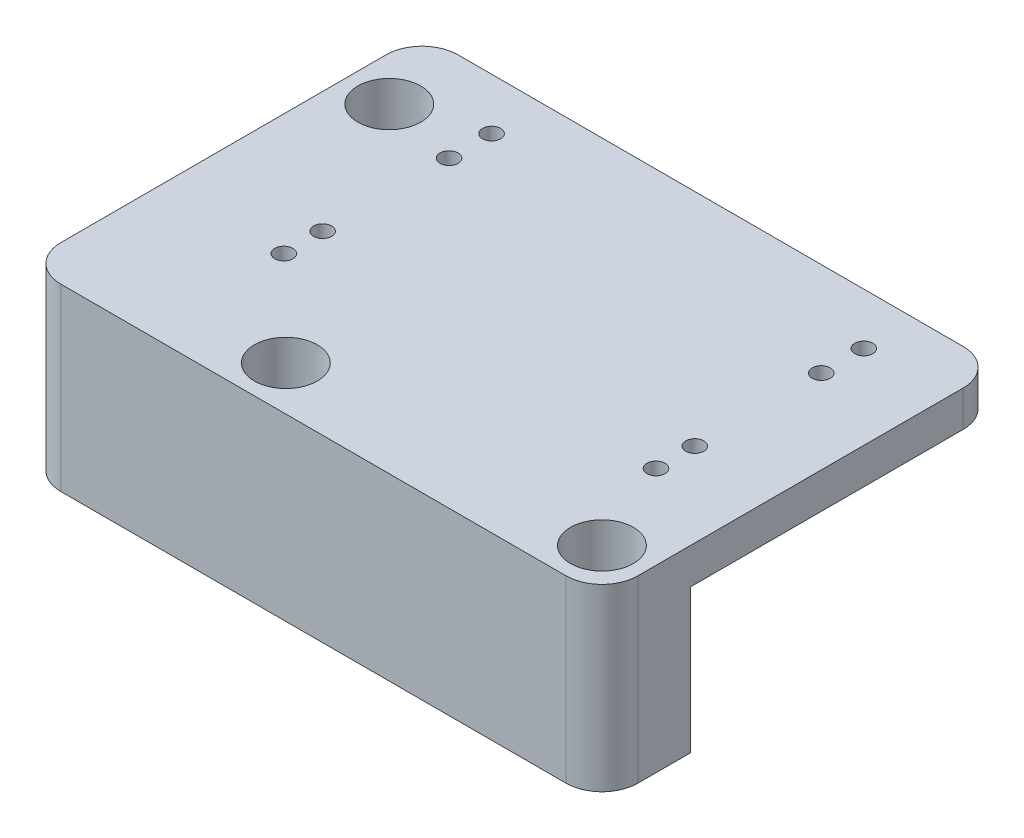
from build123d import *

# Parameters (mm, degrees)
SKETCH2_W                                      = 51.0032
SKETCH2_H                                      = 35.1028
BOSS_EXTRUDE1_DEPTH                            = 3.175
BOSS_EXTRUDE3_DEPTH                            = 12.7
M2X0_4_TAPPED_HOLE2_D                          = 1.6
CBORE_FOR_4_SOCKET_HEAD_CAP_SCREW4_D           = 3.2639
CBORE_FOR_4_SOCKET_HEAD_CAP_SCREW4_CBORE_D     = 5.55752
CBORE_FOR_4_SOCKET_HEAD_CAP_SCREW4_CBORE_DEPTH = 12.4968
FILLET1_R                                      = 3.175


with BuildPart() as part:
    # Sketch2 → Boss-Extrude1 (new body)
    with BuildSketch(Plane(origin=(0, 0, 0), x_dir=(1, 0, 0), z_dir=(0, 1, 0))):
        with Locations((-1.5621, -3.9116)):
            Rectangle(SKETCH2_W, SKETCH2_H)
    extrude(amount=BOSS_EXTRUDE1_DEPTH)

    # Sketch14 → Boss-Extrude3 (add)
    with BuildSketch(Plane.XZ):
        Polygon((-27.0637, -13.6398), (-27.0637, 21.463), (23.9395, 21.463), (23.9395, 13.6398), (-19.2405, 13.6398), (-19.2405, -13.6398), align=None)
    extrude(amount=BOSS_EXTRUDE3_DEPTH)

    # M2x0.4 Tapped Hole2 (through all)
    with Locations(Plane(origin=(0, 3.175, 0), x_dir=(1, 0, 0), z_dir=(0, 1, 0))):
        with Locations((-16.3703, 9.0932), (-16.3703, 5.334), (-16.3703, -5.842), (-16.3703, -9.271), (16.5227, -9.271), (16.5227, -5.842), (16.5227, 5.334), (16.5227, 9.0932)):
            Hole(M2X0_4_TAPPED_HOLE2_D / 2)

    # CBORE for #4 Socket Head Cap Screw4 (through all)
    with Locations(Plane(origin=(0, 3.175, 0), x_dir=(1, 0, 0), z_dir=(0, 1, 0))):
        with Locations((-23.1521, 6.8326), (-7.9121, -17.5514), (20.0279, -17.5514)):
            CounterBoreHole(CBORE_FOR_4_SOCKET_HEAD_CAP_SCREW4_D / 2, CBORE_FOR_4_SOCKET_HEAD_CAP_SCREW4_CBORE_D / 2, CBORE_FOR_4_SOCKET_HEAD_CAP_SCREW4_CBORE_DEPTH)

    # Fillet1
    fillet1_edges = [part.edges().sort_by_distance(p)[0] for p in [
        (23.9395, -4.7625, 21.463),
        (23.9395, 1.5875, -13.6398),
        (-27.0637, -4.7625, -13.6398),
        (-27.0637, -4.7625, 21.463),
    ]]
    fillet(fillet1_edges, radius=FILLET1_R)


solid = part.part
